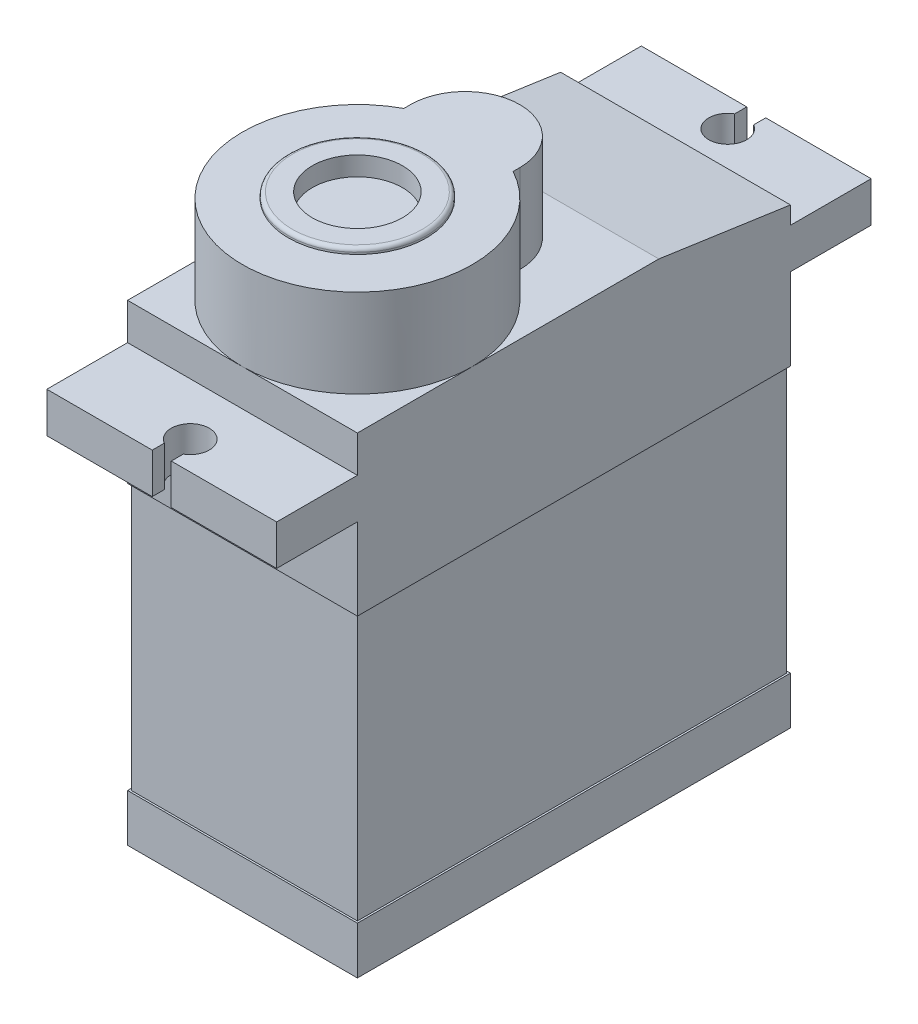
from build123d import *

# Parameters (mm, degrees)
SKETCH1_W           = 12.1
SKETCH1_H           = 22.8
BOSS_EXTRUDE1_DEPTH = 24.85
SKETCH2_OUTSIDE_W   = 31.966
SKETCH2_OUTSIDE_H   = 34.016
CUT_EXTRUDE1_DEPTH  = 24.85
SKETCH3_R           = 2.875
SKETCH3_R_2         = 6.05
BOSS_EXTRUDE2_DEPTH = 4.65
BOSS_EXTRUDE3_START = 20.8
BOSS_EXTRUDE3_DEPTH = 2.12
CUT_EXTRUDE2_START  = -2.5
SKETCH6_W           = 12.1
SKETCH6_H           = 22.8
SKETCH6_W_2         = 11.9
SKETCH6_H_2         = 22.6
CUT_EXTRUDE2_DEPTH  = 14
SKETCH8_R           = 3.625
BOSS_EXTRUDE5_DEPTH = 0.3
FILLET1_R           = 0.2
SKETCH9_R           = 2.375
CUT_EXTRUDE3_DEPTH  = 1


with BuildPart() as part:
    # Sketch1 → Boss-Extrude1 (new body)
    with BuildSketch(Plane(origin=(0, 0, 0), x_dir=(1, 0, 0), z_dir=(0, 1, 0))):
        Rectangle(SKETCH1_W, SKETCH1_H)
    extrude(amount=BOSS_EXTRUDE1_DEPTH)

    # Sketch2 outside → Cut-Extrude1 (cut)
    with BuildSketch(Plane.ZY.offset(6.05)):
        with Locations((0, 12.425)):
            Rectangle(SKETCH2_OUTSIDE_W, SKETCH2_OUTSIDE_H)
        Polygon((-11.4, 23.85), (-4.47179677, 24.85), (11.4, 24.85), (11.4, 0), (-11.4, 0), align=None, mode=Mode.SUBTRACT)
    extrude(amount=-CUT_EXTRUDE1_DEPTH, mode=Mode.SUBTRACT)

    # Sketch3 → Boss-Extrude2 (add)
    with BuildSketch(Plane(origin=(0, 24.85, 0), x_dir=(1, 0, 0), z_dir=(0, 1, 0))):
        with Locations((0, 0.325)):
            Circle(SKETCH3_R)
        with Locations((0, -5.35)):
            Circle(SKETCH3_R_2)
        with BuildLine():
            Line((2.875, -0.026760855), (2.875, 0.325))
            ThreePointArc((2.875, 0.325), (2.869926129, 0.154269175), (2.854722425, -0.015859031))
            ThreePointArc((2.854722425, -0.015859031), (2.864866398, -0.021300297), (2.875, -0.026760855))
        make_face()
        with BuildLine():
            ThreePointArc((-2.854722425, -0.015859031), (-2.869926129, 0.154269175), (-2.875, 0.325))
            Line((-2.875, 0.325), (-2.875, -0.026760855))
            ThreePointArc((-2.875, -0.026760855), (-2.864866398, -0.021300297), (-2.854722425, -0.015859031))
        make_face()
    extrude(amount=BOSS_EXTRUDE2_DEPTH)

    # Sketch4 → Boss-Extrude3 (add)
    with BuildSketch(Plane(origin=(0, 0, 0), x_dir=(1, 0, 0), z_dir=(0, 1, 0)).offset(BOSS_EXTRUDE3_START)):
        with BuildLine():
            Line((-6.05, 15.65), (-6.05, 11.4))
            Line((-6.05, 11.4), (6.05, 11.4))
            Line((6.05, 11.4), (6.05, 15.65))
            Line((6.05, 15.65), (0.5, 15.65))
            Line((0.5, 15.65), (0.5, 15.016025404))
            ThreePointArc((0.5, 15.016025404), (0.866025404, 14.65), (1, 14.15))
            ThreePointArc((1, 14.15), (-0.5, 13.283974596), (-0.5, 15.016025404))
            Line((-0.5, 15.016025404), (-0.5, 15.65))
            Line((-0.5, 15.65), (-6.05, 15.65))
        make_face()
        with BuildLine():
            Line((6.05, -11.4), (-6.05, -11.4))
            Line((-6.05, -11.4), (-6.05, -15.65))
            Line((-6.05, -15.65), (-0.5, -15.65))
            Line((-0.5, -15.65), (-0.5, -15.016025404))
            ThreePointArc((-0.5, -15.016025404), (-0.5, -13.283974596), (1, -14.15))
            ThreePointArc((1, -14.15), (0.866025404, -14.65), (0.5, -15.016025404))
            Line((0.5, -15.016025404), (0.5, -15.65))
            Line((0.5, -15.65), (6.05, -15.65))
            Line((6.05, -15.65), (6.05, -11.4))
        make_face()
    extrude(amount=BOSS_EXTRUDE3_DEPTH)

    # Sketch6 → Cut-Extrude2 (cut)
    with BuildSketch(Plane.XZ.offset(CUT_EXTRUDE2_START)):
        Rectangle(SKETCH6_W, SKETCH6_H)
        Rectangle(SKETCH6_W_2, SKETCH6_H_2, mode=Mode.SUBTRACT)
    extrude(amount=-CUT_EXTRUDE2_DEPTH, mode=Mode.SUBTRACT)

    # Sketch8 → Boss-Extrude5 (add)
    with BuildSketch(Plane(origin=(0, 29.5, 0), x_dir=(1, 0, 0), z_dir=(0, 1, 0))):
        with Locations(Location((0, -5.35, 0), (0, 0, 270))):
            Circle(SKETCH8_R)
    extrude(amount=BOSS_EXTRUDE5_DEPTH)

    # Fillet1
    fillet1_edges = [part.edges().sort_by_distance(p)[0] for p in [
        (0, 29.8, 1.725),
    ]]
    fillet(fillet1_edges, radius=FILLET1_R)

    # Sketch9 → Cut-Extrude3 (cut)
    with BuildSketch(Plane(origin=(0, 29.8, 0), x_dir=(1, 0, 0), z_dir=(0, 1, 0))):
        with Locations(Location((0, -5.35, 0), (0, 0, 270))):
            Circle(SKETCH9_R)
    extrude(amount=-CUT_EXTRUDE3_DEPTH, mode=Mode.SUBTRACT)


solid = part.part
